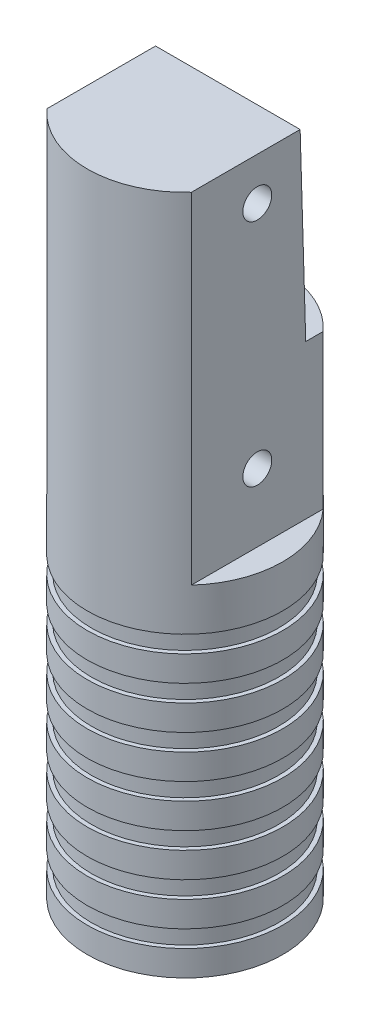
from build123d import *
from build123d.topology import SkipClean

# Parameters (mm, degrees)
SKETCH2_W                      = 11.5
SKETCH2_H                      = 40
SKETCH3_W                      = 0.5
SKETCH3_H                      = 2
LPATTERN1_COUNT                = 7
LPATTERN1_PITCH                = 5
BOSS_EXTRUDE1_DEPTH            = 40
F_15_0_15_DIAMETER_HOLE1_D     = 15
F_15_0_15_DIAMETER_HOLE1_DEPTH = 40
F_15_0_15_DIAMETER_HOLE1_TIP   = 4.506454643
M3_CLEARANCE_HOLE1_D           = 3.4
CUT_EXTRUDE1_DEPTH             = 44.179856415
CUT_EXTRUDE1_DEPTH_BACK        = 44.179856415
SKETCH16_R                     = 1.7


with BuildPart() as part:
    # Sketch2 → Revolve1 (revolve)
    with BuildSketch(Plane.XY, mode=Mode.PRIVATE) as revolve1_sk:
        with Locations((-5.75, -20)):
            Rectangle(SKETCH2_W, SKETCH2_H)
    revolve(revolve1_sk.sketch.rotate(Axis((0, 0, 0), (0, -1, 0)), 270), axis=Axis((0, 0, 0), (0, -1, 0)))

    # Sketch3 → Cut-Revolve1 (revolve, cut)
    with BuildSketch(Plane.XY, mode=Mode.PRIVATE) as cut_revolve1_sk:
        with Locations((11.25, -36)):
            Rectangle(SKETCH3_W, SKETCH3_H)
    cut_revolve1 = revolve(cut_revolve1_sk.sketch.rotate(Axis((0, 0, 0), (0, -1, 0)), 90), axis=Axis((0, 0, 0), (0, -1, 0)), mode=Mode.SUBTRACT)

    # LPattern1: Cut-Revolve1 ×7
    with Locations(*[(0, i * LPATTERN1_PITCH, 0) for i in range(1, LPATTERN1_COUNT)]):
        add(cut_revolve1, mode=Mode.SUBTRACT)

    # Sketch6 → Boss-Extrude1 (add)
    with SkipClean():  # the faces are left unmerged after this step: merging them gives an invalid solid
        with BuildSketch(Plane(origin=(0, 0, 0), x_dir=(1, 0, 0), z_dir=(0, 1, 0))):
            with BuildLine():
                Line((-8.5, 7.745966692), (-8.5, -7.745966692))
                ThreePointArc((-8.5, -7.745966692), (0, -11.5), (8.5, -7.745966692))
                Line((8.5, -7.745966692), (8.5, 7.745966692))
                ThreePointArc((8.5, 7.745966692), (0, 11.5), (-8.5, 7.745966692))
            make_face()
        extrude(amount=BOSS_EXTRUDE1_DEPTH)

    # Ø15.0 (15) Diameter Hole1
    with Locations(Plane.XZ.offset(40)):
        with Locations((0, 0)):
            Hole(F_15_0_15_DIAMETER_HOLE1_D / 2, depth=F_15_0_15_DIAMETER_HOLE1_DEPTH)
            with Locations((0, 0, -(F_15_0_15_DIAMETER_HOLE1_DEPTH + F_15_0_15_DIAMETER_HOLE1_TIP / 2))):  # 118° drill point
                Cone(0, F_15_0_15_DIAMETER_HOLE1_D / 2, F_15_0_15_DIAMETER_HOLE1_TIP, mode=Mode.SUBTRACT)

    # M3 Clearance Hole1 (through all)
    with Locations(Plane(origin=(8.5, 0, 0), x_dir=(0, 0, -1), z_dir=(1, 0, 0))):
        with Locations((0, 8), (0, 35)):
            Hole(M3_CLEARANCE_HOLE1_D / 2)

    # Sketch16 → Cut-Extrude1 (cut, two sides: drawn at the far end of the back side and taken through both)
    with SkipClean():  # the faces are left unmerged after this step: merging them gives an invalid solid
        with BuildSketch(Plane(origin=(0, 0, 0), x_dir=(0, 0, -1), z_dir=(1, 0, 0)).offset(-CUT_EXTRUDE1_DEPTH_BACK)):
            with Locations((0, 8)):
                Circle(SKETCH16_R)
            with Locations((0, 35)):
                Circle(SKETCH16_R)
            Polygon((5.037728025, 40), (5.6954411, 18.081644681), (11.5, 18.081644681), (11.5, 40), (7.745966692, 40), align=None)
        extrude(amount=CUT_EXTRUDE1_DEPTH + CUT_EXTRUDE1_DEPTH_BACK, mode=Mode.SUBTRACT)


solid = part.part
